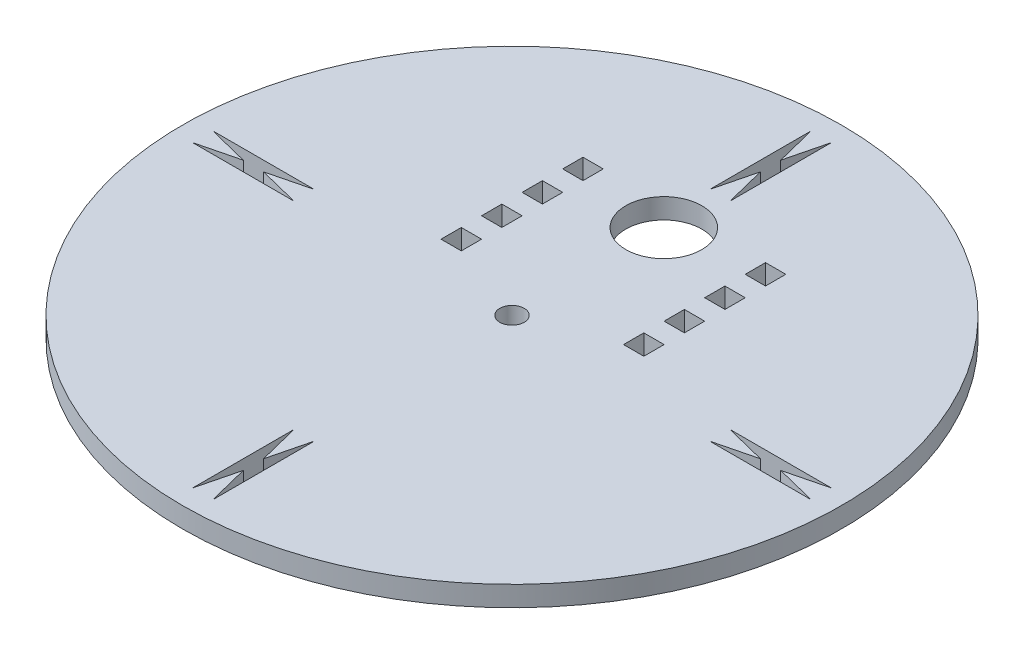
from build123d import *

# Parameters (mm, degrees)
SKETCH1_R           = 82.55
SKETCH1_R_2         = 3.048
SKETCH1_R_3         = 9.525
SKETCH1_W           = 5.08
SKETCH1_H           = 5.08
BOSS_EXTRUDE1_DEPTH = 5.08
CUT_EXTRUDE1_DEPTH  = 5.08


with BuildPart() as part:
    # Sketch1 → Boss-Extrude1 (new body)
    with BuildSketch(Plane(origin=(0, 0, 0), x_dir=(1, 0, 0), z_dir=(0, 1, 0))):
        with Locations(Location((-62.967414891, 81.40064069, 0), (0, 0, 270))):
            Circle(SKETCH1_R)
        with Locations(Location((-62.967414891, 81.40064069, 0), (0, 0, 270))):
            Circle(SKETCH1_R_2, mode=Mode.SUBTRACT)
        with Locations(Location((-62.967414891, 119.43206069, 0), (0, 0, 270))):
            Circle(SKETCH1_R_3, mode=Mode.SUBTRACT)
        with Locations((-85.827414891, 111.88064069)):
            Rectangle(SKETCH1_W, SKETCH1_H, mode=Mode.SUBTRACT)
        with Locations((-85.827414891, 91.56064069)):
            Rectangle(SKETCH1_W, SKETCH1_H, mode=Mode.SUBTRACT)
        with Locations((-85.827414891, 101.72064069)):
            Rectangle(SKETCH1_W, SKETCH1_H, mode=Mode.SUBTRACT)
        with Locations((-85.827414891, 122.04064069)):
            Rectangle(SKETCH1_W, SKETCH1_H, mode=Mode.SUBTRACT)
        with Locations((-40.107414891, 122.04064069)):
            Rectangle(SKETCH1_W, SKETCH1_H, mode=Mode.SUBTRACT)
        with Locations((-40.107414891, 111.88064069)):
            Rectangle(SKETCH1_W, SKETCH1_H, mode=Mode.SUBTRACT)
        with Locations((-40.107414891, 101.72064069)):
            Rectangle(SKETCH1_W, SKETCH1_H, mode=Mode.SUBTRACT)
        with Locations((-40.107414891, 91.56064069)):
            Rectangle(SKETCH1_W, SKETCH1_H, mode=Mode.SUBTRACT)
    extrude(amount=BOSS_EXTRUDE1_DEPTH)

    # Sketch2 → Cut-Extrude1 (cut)
    with BuildSketch(Plane(origin=(0, 5.08, 0), x_dir=(1, 0, 0), z_dir=(0, 1, 0))):
        Polygon((-62.967414891, 148.71064069), (-60.427414891, 158.87064069), (-60.427414891, 133.47064069), (-62.967414891, 143.63064069), (-65.507414891, 133.47064069), (-65.507414891, 158.87064069), align=None)
        Polygon((4.342585109, 81.40064069), (14.502585109, 78.86064069), (-10.897414891, 78.86064069), (-0.737414891, 81.40064069), (-10.897414891, 83.94064069), (14.502585109, 83.94064069), align=None)
        Polygon((-62.967414891, 14.09064069), (-65.507414891, 3.93064069), (-65.507414891, 29.33064069), (-62.967414891, 19.17064069), (-60.427414891, 29.33064069), (-60.427414891, 3.93064069), align=None)
        Polygon((-130.277414891, 81.40064069), (-140.437414891, 83.94064069), (-115.037414891, 83.94064069), (-125.197414891, 81.40064069), (-115.037414891, 78.86064069), (-140.437414891, 78.86064069), align=None)
    extrude(amount=-CUT_EXTRUDE1_DEPTH, mode=Mode.SUBTRACT)


solid = part.part
